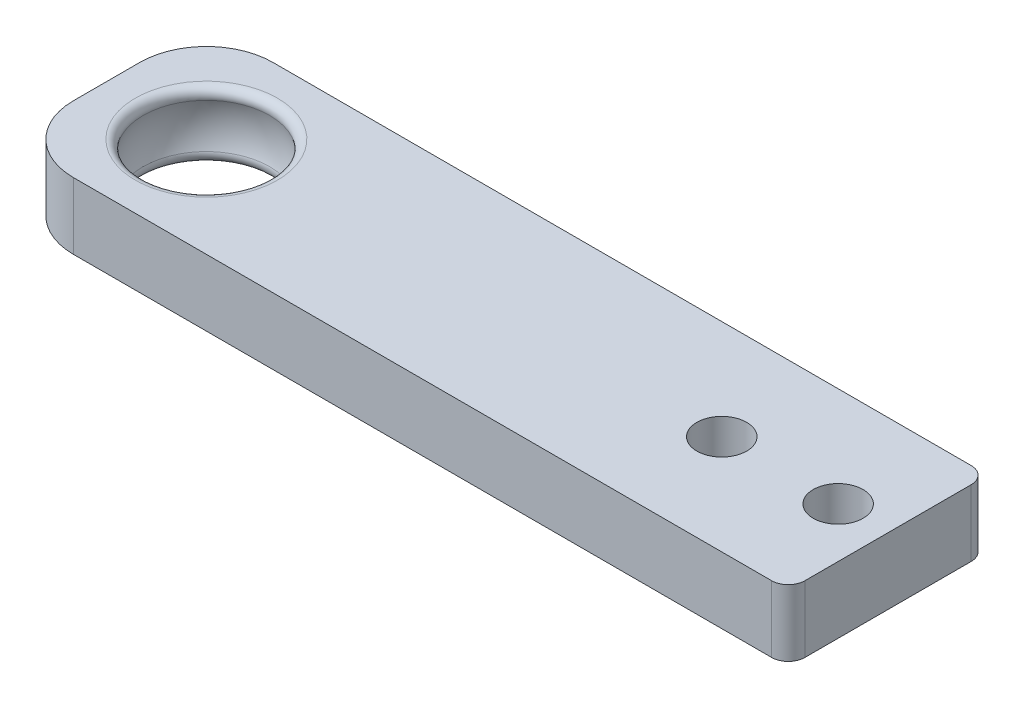
from build123d import *

# Parameters (mm, degrees)
SKETCH1_W           = 32
SKETCH1_H           = 12
BOSS_EXTRUDE1_DEPTH = 4
FILLET1_R           = 4
FILLET2_R           = 0.5
SKETCH3_W           = 12
SKETCH3_H           = 4
BOSS_EXTRUDE2_DEPTH = 15
SKETCH5_R           = 1.5
CUT_EXTRUDE1_DEPTH  = 32.827661054
FILLET4_R           = 1


with BuildPart() as part:
    # Sketch1 → Boss-Extrude1 (new body)
    with BuildSketch(Plane(origin=(0, 0, 0), x_dir=(1, 0, 0), z_dir=(0, 1, 0))):
        Rectangle(SKETCH1_W, SKETCH1_H)
    extrude(amount=BOSS_EXTRUDE1_DEPTH)

    # Sketch2 → Cut-Revolve1 (revolve, cut)
    with BuildSketch(Plane.XY):
        with BuildLine():
            Line((-10, 4), (-10, 0))
            Line((-10, 0), (-13.5, 0))
            ThreePointArc((-13.5, 0), (-14.031128874, 2), (-13.5, 4))
            Line((-13.5, 4), (-10, 4))
        make_face()
    revolve(axis=Axis((-10, 4, 0), (0, -1, 0)), mode=Mode.SUBTRACT)

    # Fillet1
    fillet1_edges = [part.edges().sort_by_distance(p)[0] for p in [
        (-16, 2, -6),
        (-16, 2, 6),
    ]]
    fillet(fillet1_edges, radius=FILLET1_R)

    # Fillet2
    fillet2_edges = [part.edges().sort_by_distance(p)[0] for p in [
        (-6.5, 4, 0),
        (-6.5, 0, 0),
    ]]
    fillet(fillet2_edges, radius=FILLET2_R)

    # Sketch3 → Boss-Extrude2 (add)
    with BuildSketch(Plane(origin=(16, 0, 0), x_dir=(0, 0, -1), z_dir=(1, 0, 0))):
        with Locations((0, 2)):
            Rectangle(SKETCH3_W, SKETCH3_H)
    extrude(amount=BOSS_EXTRUDE2_DEPTH)

    # Sketch5 → Cut-Extrude1 (cut, through all)
    with BuildSketch(Plane(origin=(0, 4, 0), x_dir=(1, 0, 0), z_dir=(0, 1, 0))):
        with Locations(Location((21, 0, 0), (0, 0, 270))):
            Circle(SKETCH5_R)
        with Locations(Location((28, 0, 0), (0, 0, 270))):
            Circle(SKETCH5_R)
    extrude(amount=-CUT_EXTRUDE1_DEPTH, mode=Mode.SUBTRACT)

    # Fillet4
    fillet4_edges = [part.edges().sort_by_distance(p)[0] for p in [
        (31, 2, 6),
        (31, 2, -6),
    ]]
    fillet(fillet4_edges, radius=FILLET4_R)


solid = part.part
